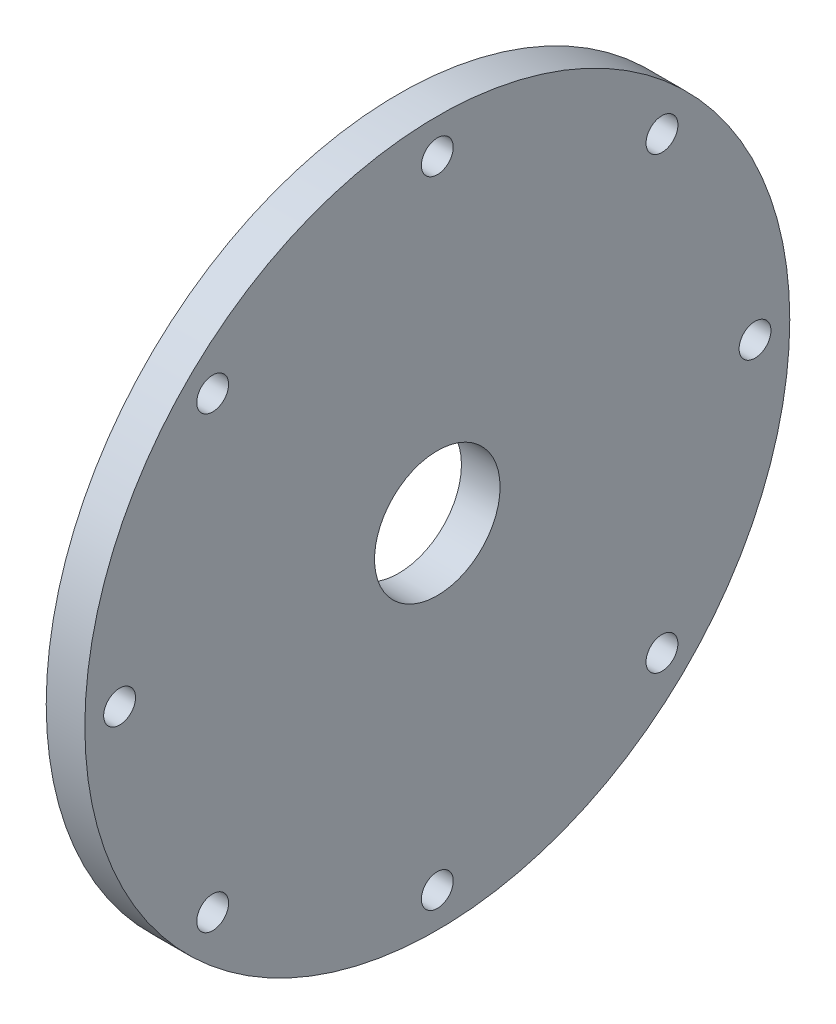
from build123d import *

# Parameters (mm, degrees)
SKETCH_1_R          = 36.5
SKETCH_1_R_2        = 6.5
EXTRUDE_1_DEPTH     = 4
SKETCH_2_R          = 1.65
CUT_EXTRUDE_1_DEPTH = 6


with BuildPart() as part:
    # 草图1 → 凸台-拉伸1 (new body)
    with BuildSketch(Plane(origin=(0, 0, 0), x_dir=(0, 0, -1), z_dir=(1, 0, 0))):
        Circle(SKETCH_1_R)
        Circle(SKETCH_1_R_2, mode=Mode.SUBTRACT)
    extrude(amount=EXTRUDE_1_DEPTH)

    # 草图2 → 切除-拉伸1 (cut)
    with BuildSketch(Plane(origin=(4, 0, 0), x_dir=(0, 0, -1), z_dir=(1, 0, 0))):
        with Locations((32.9, 0)):
            Circle(SKETCH_2_R)
        with Locations((23.263813101, -23.263813101)):
            Circle(SKETCH_2_R)
        with Locations((0, -32.9)):
            Circle(SKETCH_2_R)
        with Locations((-23.263813101, -23.263813101)):
            Circle(SKETCH_2_R)
        with Locations((-32.9, 0)):
            Circle(SKETCH_2_R)
        with Locations((-23.263813101, 23.263813101)):
            Circle(SKETCH_2_R)
        with Locations((0, 32.9)):
            Circle(SKETCH_2_R)
        with Locations((23.263813101, 23.263813101)):
            Circle(SKETCH_2_R)
    extrude(amount=-CUT_EXTRUDE_1_DEPTH, mode=Mode.SUBTRACT)


solid = part.part
